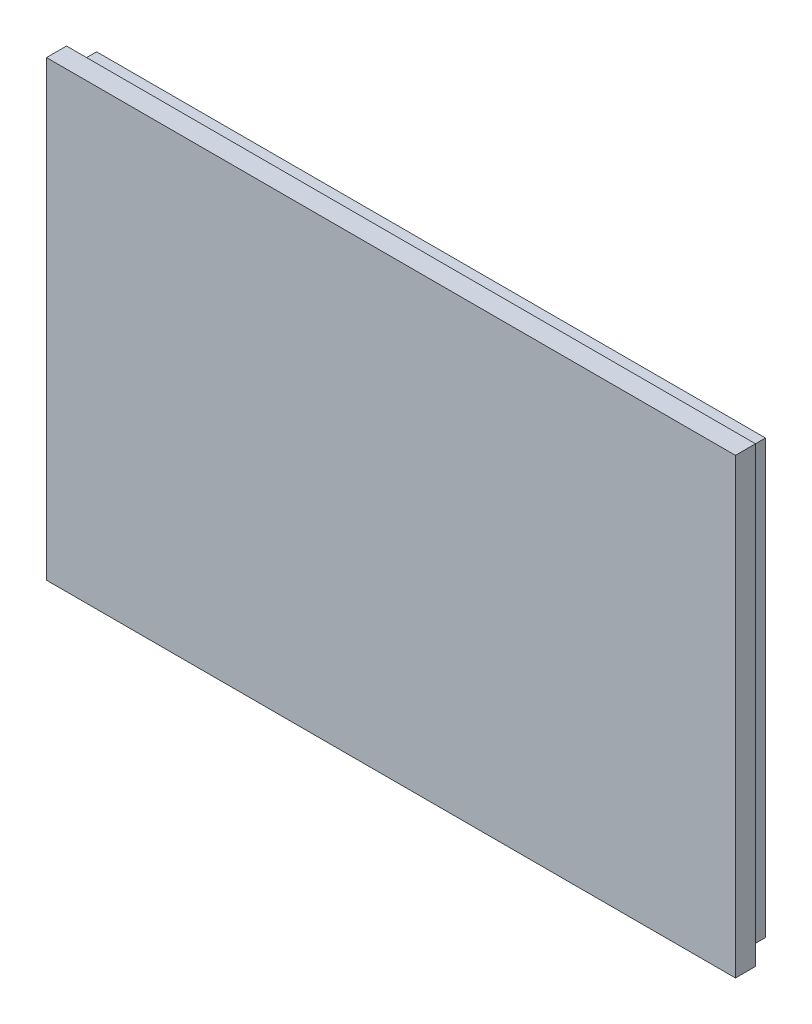
from build123d import *

# Parameters (mm, degrees)
SKETCH1_W           = 34.4
SKETCH1_H           = 22.6
BOSS_EXTRUDE1_DEPTH = 1
SKETCH2_W           = 33.4
SKETCH2_H           = 21.6
BOSS_EXTRUDE2_DEPTH = 1


with BuildPart() as part:
    # Sketch1 → Boss-Extrude1 (new body)
    with BuildSketch(Plane.XY):
        Rectangle(SKETCH1_W, SKETCH1_H)
    extrude(amount=BOSS_EXTRUDE1_DEPTH)

    # Sketch2 → Boss-Extrude2 (add)
    with BuildSketch(Plane(origin=(0, 0, 0), x_dir=(-1, 0, 0), z_dir=(0, 0, -1))):
        Rectangle(SKETCH2_W, SKETCH2_H)
    extrude(amount=BOSS_EXTRUDE2_DEPTH)


solid = part.part
